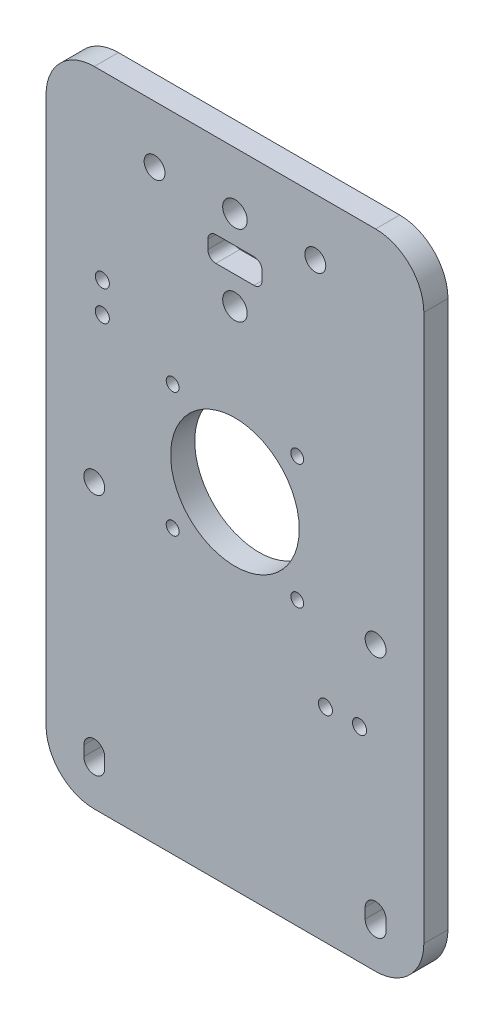
from build123d import *

# Parameters (mm, degrees)
MODEL_R                         = 16
MODEL_R_2                       = 3.05
MODEL_R_3                       = 2.6
MODEL_W                         = 13.5
MODEL_H                         = 6.2
BASE_DEPTH                      = 6
SKETCH1_R                       = 1.75
SENSORMOUNT_DEPTH               = 167.868211472
SKETCH2_R                       = 1.75
CABLEMOUNT_DEPTH                = 10
FILLETCABLESLOT_R               = 2
F_3_2_3_2_STEPPER_MOUNT_HOLES_D = 3.2


with BuildPart() as part:
    # Model → Base (new body)
    with BuildSketch(Plane.XY):
        with BuildLine():
            Line((-35, 160), (35, 160))
            ThreePointArc((35, 160), (43.485281374, 156.485281374), (47, 148))
            Line((47, 148), (47, 12))
            ThreePointArc((47, 12), (43.485281374, 3.514718626), (35, 0))
            Line((35, 0), (-35, 0))
            ThreePointArc((-35, 0), (-43.485281374, 3.514718626), (-47, 12))
            Line((-47, 12), (-47, 148))
            ThreePointArc((-47, 148), (-43.485281374, 156.485281374), (-35, 160))
        make_face()
        with Locations((0, 85.8)):
            Circle(MODEL_R, mode=Mode.SUBTRACT)
        with Locations((0, 145.8)):
            Circle(MODEL_R_2, mode=Mode.SUBTRACT)
        with Locations((-20, 145.8)):
            Circle(MODEL_R_3, mode=Mode.SUBTRACT)
        with Locations((20, 145.8)):
            Circle(MODEL_R_3, mode=Mode.SUBTRACT)
        with Locations((-35, 70.45)):
            Circle(MODEL_R_3, mode=Mode.SUBTRACT)
        with Locations((0, 125.8)):
            Circle(MODEL_R_2, mode=Mode.SUBTRACT)
        with Locations((35, 70.45)):
            Circle(MODEL_R_3, mode=Mode.SUBTRACT)
        with BuildLine():
            Line((-32.4, 12.5), (-32.4, 10))
            ThreePointArc((-32.4, 10), (-35, 7.4), (-37.6, 10))
            Line((-37.6, 10), (-37.6, 12.5))
            ThreePointArc((-37.6, 12.5), (-35, 15.1), (-32.4, 12.5))
        make_face(mode=Mode.SUBTRACT)
        with BuildLine():
            Line((32.4, 12.5), (32.4, 10))
            ThreePointArc((32.4, 10), (35, 7.4), (37.6, 10))
            Line((37.6, 10), (37.6, 12.5))
            ThreePointArc((37.6, 12.5), (35, 15.1), (32.4, 12.5))
        make_face(mode=Mode.SUBTRACT)
        with Locations((0, 135.8)):
            Rectangle(MODEL_W, MODEL_H, mode=Mode.SUBTRACT)
    extrude(amount=BASE_DEPTH)

    # Sketch1 → SensorMount (cut, through all)
    with BuildSketch(Plane.XY.offset(6)):
        with Locations((-33, 115)):
            Circle(SKETCH1_R)
        with Locations((-33, 107.5)):
            Circle(SKETCH1_R)
    extrude(amount=-SENSORMOUNT_DEPTH, mode=Mode.SUBTRACT)

    # Sketch2 → CableMount (cut)
    with BuildSketch(Plane.XY.offset(6)):
        with Locations((22.5, 50.76)):
            Circle(SKETCH2_R)
        with Locations((31, 50.76)):
            Circle(SKETCH2_R)
    extrude(amount=-CABLEMOUNT_DEPTH, mode=Mode.SUBTRACT)

    # FilletCableSlot
    filletcableslot_edges = [part.edges().sort_by_distance(p)[0] for p in [
        (6.75, 138.9, 3),
        (-6.75, 138.9, 3),
        (-6.75, 132.7, 3),
        (6.75, 132.7, 3),
    ]]
    fillet(filletcableslot_edges, radius=FILLETCABLESLOT_R)

    # Ø3.2 (3.2) Stepper mount Holes (through all)
    with Locations(Plane.XY.offset(6)):
        with Locations((-15.5, 101.3), (-15.5, 70.3), (15.5, 70.3), (15.5, 101.3)):
            Hole(F_3_2_3_2_STEPPER_MOUNT_HOLES_D / 2)


solid = part.part
